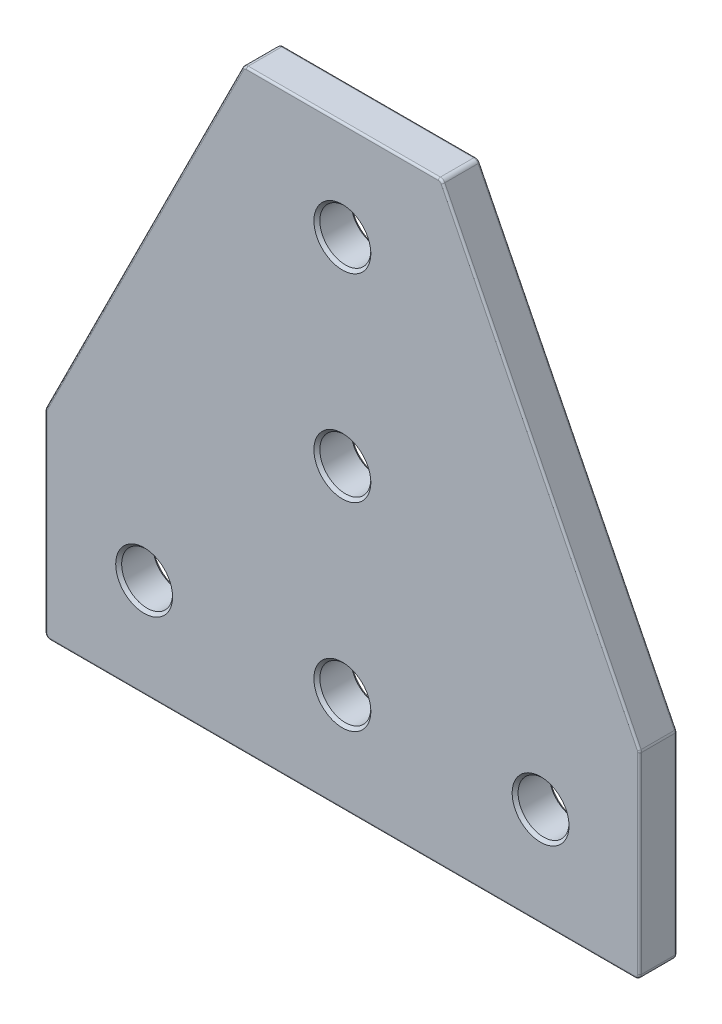
from build123d import *

# Parameters (mm, degrees)
BOSS_EXTRUDE1_START        = -2.3876
BOSS_EXTRUDE1_DEPTH        = 4.7752
SKETCH4_R                  = 3.2639
CUT_EXTRUDE1_DEPTH         = 55.092721646
CHAMFER1_SIZE              = 0.381
LPATTERN1_COUNT            = 3
LPATTERN1_PITCH            = 25.4
LPATTERN1_COUNT_DIR2       = 3
LPATTERN1_PITCH_DIR2       = 25.4
CHAMFER1_OF_LPATTERN1_SIZE = 0.381
FILLET1_R                  = 0.635
FILLET2_R                  = 0.254


with BuildPart() as part:
    # Sketch3 → Boss-Extrude1 (new body)
    with BuildSketch(Plane.XY.offset(BOSS_EXTRUDE1_START)):
        Polygon((-38.1, -38.1), (-38.1, -12.7), (-12.7, 38.1), (12.7, 38.1), (38.1, -12.7), (38.1, -38.1), align=None)
    extrude(amount=BOSS_EXTRUDE1_DEPTH)

    # Sketch4 → Cut-Extrude1 (cut, through all)
    with BuildSketch(Plane.XY.offset(2.3876)):
        with Locations((-25.4, -25.4)):
            Circle(SKETCH4_R)
    cut_extrude1 = extrude(amount=-CUT_EXTRUDE1_DEPTH, mode=Mode.SUBTRACT)

    # Chamfer1
    chamfer1_edges = [part.edges().sort_by_distance(p)[0] for p in [
        (-28.6639, -25.4, -2.3876),
        (-28.6639, -25.4, 2.3876),
    ]]
    chamfer(chamfer1_edges, length=CHAMFER1_SIZE)

    # LPattern1: Cut-Extrude1 3 × 3, 4 skipped
    with Locations(*[(i * LPATTERN1_PITCH, j * LPATTERN1_PITCH_DIR2, 0) for i in range(LPATTERN1_COUNT) for j in range(LPATTERN1_COUNT_DIR2) if (i, j) not in ((0, 0), (0, 1), (0, 2), (2, 1), (2, 2))]):
        add(cut_extrude1, mode=Mode.SUBTRACT)

    # Chamfer1 of LPattern1
    chamfer1_of_lpattern1_edges = [part.edges().sort_by_distance(p)[0] for p in [
        (-3.2639, -25.4, -2.3876),
        (-3.2639, -25.4, 2.3876),
        (-3.2639, 0, -2.3876),
        (-3.2639, 0, 2.3876),
        (-3.2639, 25.4, -2.3876),
        (-3.2639, 25.4, 2.3876),
        (22.1361, -25.4, -2.3876),
        (22.1361, -25.4, 2.3876),
    ]]
    chamfer(chamfer1_of_lpattern1_edges, length=CHAMFER1_OF_LPATTERN1_SIZE)

    # Fillet1
    fillet1_edges = [part.edges().sort_by_distance(p)[0] for p in [
        (-38.1, -38.1, 0),
        (-38.1, -12.7, 0),
        (-12.7, 38.1, 0),
        (12.7, 38.1, 0),
        (38.1, -12.7, 0),
        (38.1, -38.1, 0),
    ]]
    fillet(fillet1_edges, radius=FILLET1_R)

    # Fillet2
    fillet2_edges = [part.edges().sort_by_distance(p)[0] for p in [
        (0, -38.1, -2.3876),
        (0, -38.1, 2.3876),
        (-38.1, -25.157451583, -2.3876),
        (-25.454235475, 12.59152905, -2.3876),
        (0, 38.1, -2.3876),
        (25.454235475, 12.59152905, -2.3876),
        (38.1, -25.157451583, -2.3876),
        (38.083013108, -12.704010061, -2.3876),
        (37.914012806, -37.914012806, -2.3876),
        (12.641387673, 38.005163263, -2.3876),
        (-12.641387673, 38.005163263, -2.3876),
        (-38.083013108, -12.704010061, -2.3876),
        (-37.914012806, -37.914012806, -2.3876),
        (-38.1, -25.157451583, 2.3876),
        (38.1, -25.157451583, 2.3876),
        (25.454235475, 12.59152905, 2.3876),
        (0, 38.1, 2.3876),
        (-25.454235475, 12.59152905, 2.3876),
        (38.083013108, -12.704010061, 2.3876),
        (37.914012806, -37.914012806, 2.3876),
        (12.641387673, 38.005163263, 2.3876),
        (-12.641387673, 38.005163263, 2.3876),
        (-38.083013108, -12.704010061, 2.3876),
        (-37.914012806, -37.914012806, 2.3876),
    ]]
    fillet(fillet2_edges, radius=FILLET2_R)


solid = part.part
